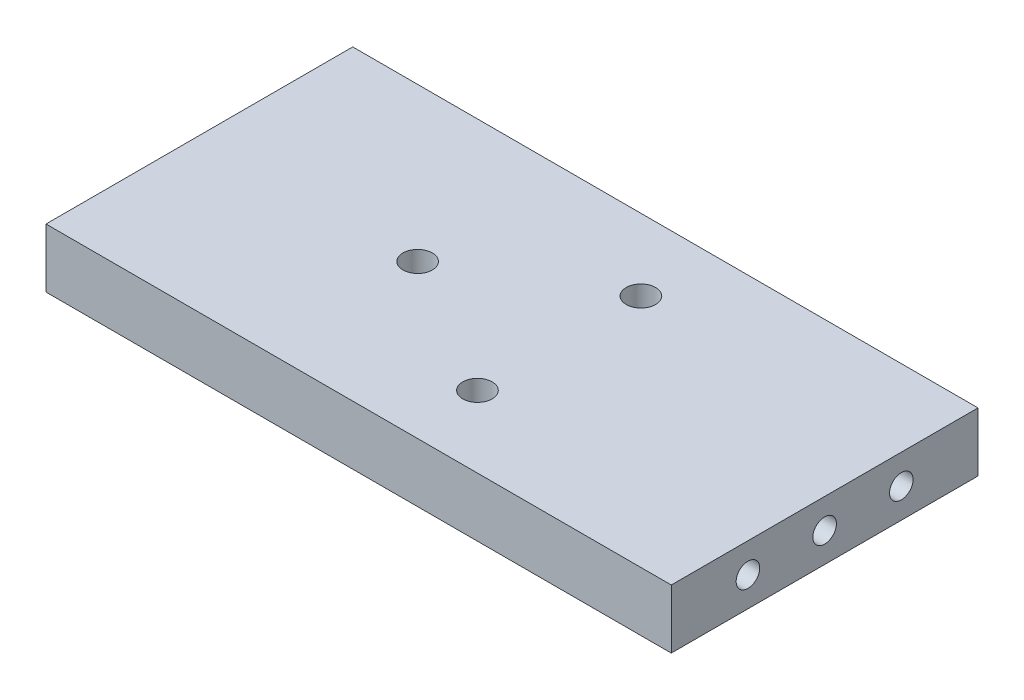
from build123d import *

# Parameters (mm, degrees)
SKETCH1_W                 = 53
SKETCH1_H                 = 26
BOSS_EXTRUDE1_DEPTH       = 5
F_2_0MM_DOWEL_HOLE4_D     = 2
F_2_0MM_DOWEL_HOLE4_DEPTH = 7
F_2_0MM_DOWEL_HOLE4_TIP   = 0.600860619
F_2_0MM_DOWEL_HOLE6_D     = 2
F_2_0MM_DOWEL_HOLE6_DEPTH = 7
F_2_0MM_DOWEL_HOLE6_TIP   = 0.600860619
F_2_5MM_DOWEL_HOLE1_D     = 2.5
F_2_5MM_DOWEL_HOLE1_DEPTH = 5
F_2_5MM_DOWEL_HOLE1_TIP   = 0.751075774


with BuildPart() as part:
    # Sketch1 → Boss-Extrude1 (new body)
    with BuildSketch(Plane(origin=(0, 0, 0), x_dir=(1, 0, 0), z_dir=(0, 1, 0))):
        with Locations((26.5, 13)):
            Rectangle(SKETCH1_W, SKETCH1_H)
    extrude(amount=BOSS_EXTRUDE1_DEPTH)

    # Ø2.0mm Dowel Hole4
    with Locations(Plane(origin=(53, 2.5, -6.5), x_dir=(0, 0, 1), z_dir=(1, 0, 0))):
        with Locations((0, 0), (-6.5, 0), (-13, 0)):
            Hole(F_2_0MM_DOWEL_HOLE4_D / 2, depth=F_2_0MM_DOWEL_HOLE4_DEPTH)
            with Locations((0, 0, -(F_2_0MM_DOWEL_HOLE4_DEPTH + F_2_0MM_DOWEL_HOLE4_TIP / 2))):  # 118° drill point
                Cone(0, F_2_0MM_DOWEL_HOLE4_D / 2, F_2_0MM_DOWEL_HOLE4_TIP, mode=Mode.SUBTRACT)

    # Ø2.0mm Dowel Hole6
    with Locations(Plane.ZY):
        with Locations((-19.5, 2.5), (-13, 2.5), (-6.5, 2.5)):
            Hole(F_2_0MM_DOWEL_HOLE6_D / 2, depth=F_2_0MM_DOWEL_HOLE6_DEPTH)
            with Locations((0, 0, -(F_2_0MM_DOWEL_HOLE6_DEPTH + F_2_0MM_DOWEL_HOLE6_TIP / 2))):  # 118° drill point
                Cone(0, F_2_0MM_DOWEL_HOLE6_D / 2, F_2_0MM_DOWEL_HOLE6_TIP, mode=Mode.SUBTRACT)

    # Ø2.5mm Dowel Hole1
    with Locations(Plane(origin=(18.5, 5, -13), x_dir=(0, 0, 1), z_dir=(0, 1, 0))):
        with Locations((0, 0), (-6.92820323, 12), (6.92820323, 12)):
            Hole(F_2_5MM_DOWEL_HOLE1_D / 2, depth=F_2_5MM_DOWEL_HOLE1_DEPTH)
            with Locations((0, 0, -(F_2_5MM_DOWEL_HOLE1_DEPTH + F_2_5MM_DOWEL_HOLE1_TIP / 2))):  # 118° drill point
                Cone(0, F_2_5MM_DOWEL_HOLE1_D / 2, F_2_5MM_DOWEL_HOLE1_TIP, mode=Mode.SUBTRACT)


solid = part.part
